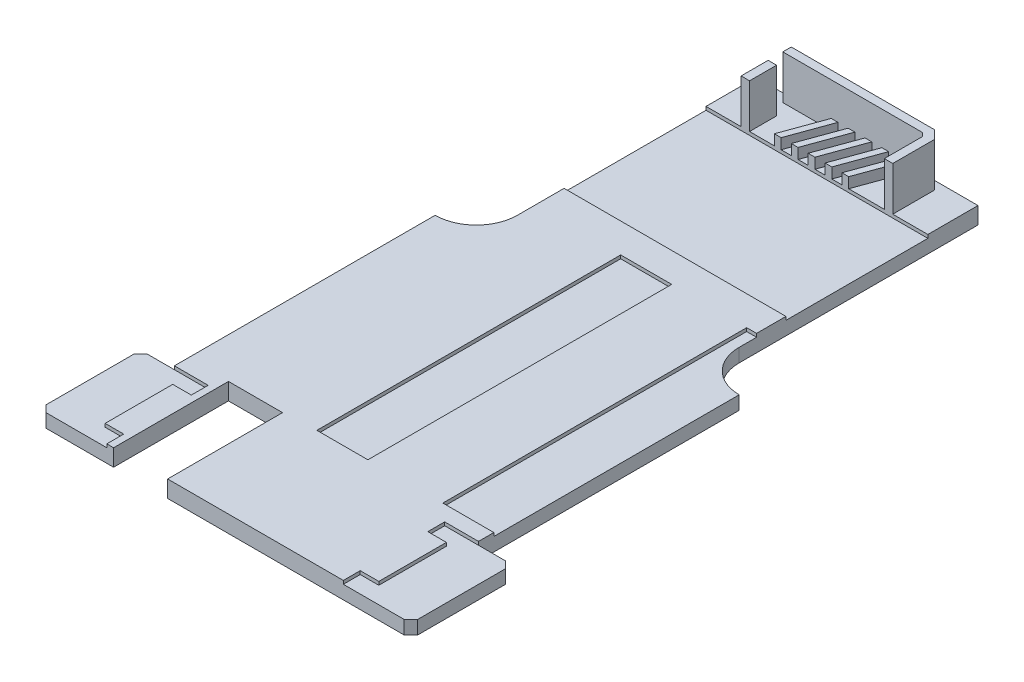
from build123d import *

# Parameters (mm, degrees)
SKETCH1_W                = 90
SKETCH1_H                = 190
BOSS_EXTRUDE1_DEPTH      = 5
SKETCH2_W                = 10
SKETCH2_H                = 30
BOSS_EXTRUDE2_DEPTH      = 5
CHAMFER1_SIZE            = 2
SKETCH3_W                = 16
SKETCH3_H                = 34
CUT_EXTRUDE1_DEPTH       = 50
SKETCH4_W                = 90
SKETCH4_H                = 42
CUT_EXTRUDE2_DEPTH       = 1
SKETCH7_W                = 15.1
SKETCH7_H                = 89.916335477
CUT_EXTRUDE7_DEPTH       = 1
CUT_EXTRUDE9_DEPTH       = 110.886304879
CUT_EXTRUDE9_DEPTH_BACK  = 110.886304879
CUT_EXTRUDE10_DEPTH      = 110.886304879
CUT_EXTRUDE10_DEPTH_BACK = 110.886304879
BOSS_EXTRUDE4_START      = 5
SKETCH17_W               = 2.5
SKETCH17_H               = 8
BOSS_EXTRUDE4_DEPTH      = 13
BOSS_EXTRUDE5_DEPTH      = 3.1
CUT_EXTRUDE11_START      = 5
CUT_EXTRUDE11_DEPTH      = 1


with BuildPart() as part:
    # Sketch1 → Boss-Extrude1 (new body)
    with BuildSketch(Plane(origin=(0, 0, 0), x_dir=(1, 0, 0), z_dir=(0, 1, 0))):
        Rectangle(SKETCH1_W, SKETCH1_H)
    extrude(amount=BOSS_EXTRUDE1_DEPTH)

    # Sketch2 → Boss-Extrude2 (add)
    with BuildSketch(Plane(origin=(0, 0, 0), x_dir=(1, 0, 0), z_dir=(0, 1, 0))):
        with Locations((-50, -80)):
            Rectangle(SKETCH2_W, SKETCH2_H)
        with Locations((50, -80)):
            Rectangle(SKETCH2_W, SKETCH2_H)
    extrude(amount=BOSS_EXTRUDE2_DEPTH)

    # Chamfer1
    chamfer1_edges = [part.edges().sort_by_distance(p)[0] for p in [
        (-55, 2.5, 65),
        (-55, 2.5, 95),
        (55, 2.5, 95),
        (55, 2.5, 65),
    ]]
    chamfer(chamfer1_edges, length=CHAMFER1_SIZE)

    # Sketch3 → Cut-Extrude1 (cut)
    with BuildSketch(Plane(origin=(0, 5, 0), x_dir=(1, 0, 0), z_dir=(0, 1, 0))):
        with Locations((-25, -78)):
            Rectangle(SKETCH3_W, SKETCH3_H)
    extrude(amount=-CUT_EXTRUDE1_DEPTH, mode=Mode.SUBTRACT)

    # Sketch4 → Cut-Extrude2 (cut)
    with BuildSketch(Plane(origin=(0, 5, 0), x_dir=(1, 0, 0), z_dir=(0, 1, 0))):
        with Locations((0, 59.159820088)):
            Rectangle(SKETCH4_W, SKETCH4_H)
    extrude(amount=-CUT_EXTRUDE2_DEPTH, mode=Mode.SUBTRACT)

    # Sketch7 → Cut-Extrude7 (cut)
    with BuildSketch(Plane(origin=(0, 5, 0), x_dir=(1, 0, 0), z_dir=(0, 1, 0))):
        with Locations((37.45, -15.495273531)):
            Rectangle(SKETCH7_W, SKETCH7_H)
        with Locations((0.16773297, -15.495273531)):
            Rectangle(SKETCH7_W, SKETCH7_H)
    extrude(amount=-CUT_EXTRUDE7_DEPTH, mode=Mode.SUBTRACT)

    # Sketch14 → Cut-Extrude9 (cut, two sides: drawn at the far end of the back side and taken through both)
    with BuildSketch(Plane(origin=(0, 0, 0), x_dir=(1, 0, 0), z_dir=(0, 1, 0)).offset(-CUT_EXTRUDE9_DEPTH_BACK)):
        with BuildLine():
            Line((-45, 47.267125731), (-34.685032462, 30.799006468))
            ThreePointArc((-34.685032462, 30.799006468), (-34.351546651, 18.443044928), (-45, 12.166784925))
            Line((-45, 12.166784925), (-45, 47.267125731))
        make_face()
        with BuildLine():
            Line((45, 47.267125731), (45, 12.166784925))
            ThreePointArc((45, 12.166784925), (34.351546651, 18.443044928), (34.685032462, 30.799006468))
            Line((34.685032462, 30.799006468), (45, 47.267125731))
        make_face()
    extrude(amount=CUT_EXTRUDE9_DEPTH + CUT_EXTRUDE9_DEPTH_BACK, mode=Mode.SUBTRACT)

    # Sketch16 → Cut-Extrude10 (cut, two sides: drawn at the far end of the back side and taken through both)
    with BuildSketch(Plane(origin=(0, 0, 0), x_dir=(1, 0, 0), z_dir=(0, 1, 0)).offset(-CUT_EXTRUDE10_DEPTH_BACK)):
        with BuildLine():
            Line((-32.828659242, 95), (-32.828659242, 24.338125683))
            ThreePointArc((-32.828659242, 24.338125683), (-33.30195485, 27.699267678), (-34.685032462, 30.799006468))
            Line((-34.685032462, 30.799006468), (-45, 47.267125731))
            Line((-45, 47.267125731), (-45, 95))
            Line((-45, 95), (-32.828659242, 95))
        make_face()
        with BuildLine():
            Line((45, 95), (32.828659242, 95))
            Line((32.828659242, 95), (32.828659242, 24.338125683))
            ThreePointArc((32.828659242, 24.338125683), (33.30195485, 27.699267678), (34.685032462, 30.799006468))
            Line((34.685032462, 30.799006468), (45, 47.267125731))
            Line((45, 47.267125731), (45, 95))
        make_face()
    extrude(amount=CUT_EXTRUDE10_DEPTH + CUT_EXTRUDE10_DEPTH_BACK, mode=Mode.SUBTRACT)

    # Sketch17 → Boss-Extrude4 (add)
    with BuildSketch(Plane(origin=(0, 0, 0), x_dir=(1, 0, 0), z_dir=(0, 1, 0)).offset(BOSS_EXTRUDE4_START)):
        with Locations((-21.190023983, 84.159820088)):
            Rectangle(SKETCH17_W, SKETCH17_H)
        Polygon((-22.440023983, 94.999820088), (-22.440023983, 92.499820088), (18.940023983, 92.499820088), (19.940023983, 91.499820088), (19.940023983, 80.159820088), (22.440023983, 80.159820088), (22.440023983, 92.535353994), (19.975557889, 94.999820088), align=None)
    extrude(amount=BOSS_EXTRUDE4_DEPTH)

    # Sketch18 → Boss-Extrude5 (add)
    with BuildSketch(Plane(origin=(0, 5, 0), x_dir=(1, 0, 0), z_dir=(0, 1, 0))):
        Polygon((-12.599634528, 80.159820088), (-10.599634528, 80.159820088), (-6.108241837, 92.499820088), (-8.108241837, 92.499820088), align=None)
        Polygon((-3.108241837, 92.499820088), (-7.599634528, 80.159820088), (-5.599634528, 80.159820088), (-1.108241837, 92.499820088), align=None)
        Polygon((1.891758163, 92.499820088), (-2.599634528, 80.159820088), (-0.599634528, 80.159820088), (3.891758163, 92.499820088), align=None)
        Polygon((6.891758163, 92.499820088), (2.400365472, 80.159820088), (4.400365472, 80.159820088), (8.891758163, 92.499820088), align=None)
        Polygon((11.891758163, 92.499820088), (7.400365472, 80.159820088), (9.400365472, 80.159820088), (13.891758163, 92.499820088), align=None)
    extrude(amount=BOSS_EXTRUDE5_DEPTH)

    # Sketch19 → Cut-Extrude11 (cut)
    with BuildSketch(Plane(origin=(0, 0, 0), x_dir=(1, 0, 0), z_dir=(0, 1, 0)).offset(CUT_EXTRUDE11_START)):
        Polygon((-35, -65), (-35, -70), (-40.5, -70), (-40.5, -90), (-35, -90), (-35, -95), (-53, -95), (-55, -93), (-55, -67), (-53, -65), align=None)
    cut_extrude11 = extrude(amount=-CUT_EXTRUDE11_DEPTH, mode=Mode.SUBTRACT)

    # Mirror1: Cut-Extrude11 across plane
    add(cut_extrude11.mirror(Plane(origin=(0, 0, 0), x_dir=(0, 0, 1), z_dir=(1, 0, 0))), mode=Mode.SUBTRACT)


solid = part.part
